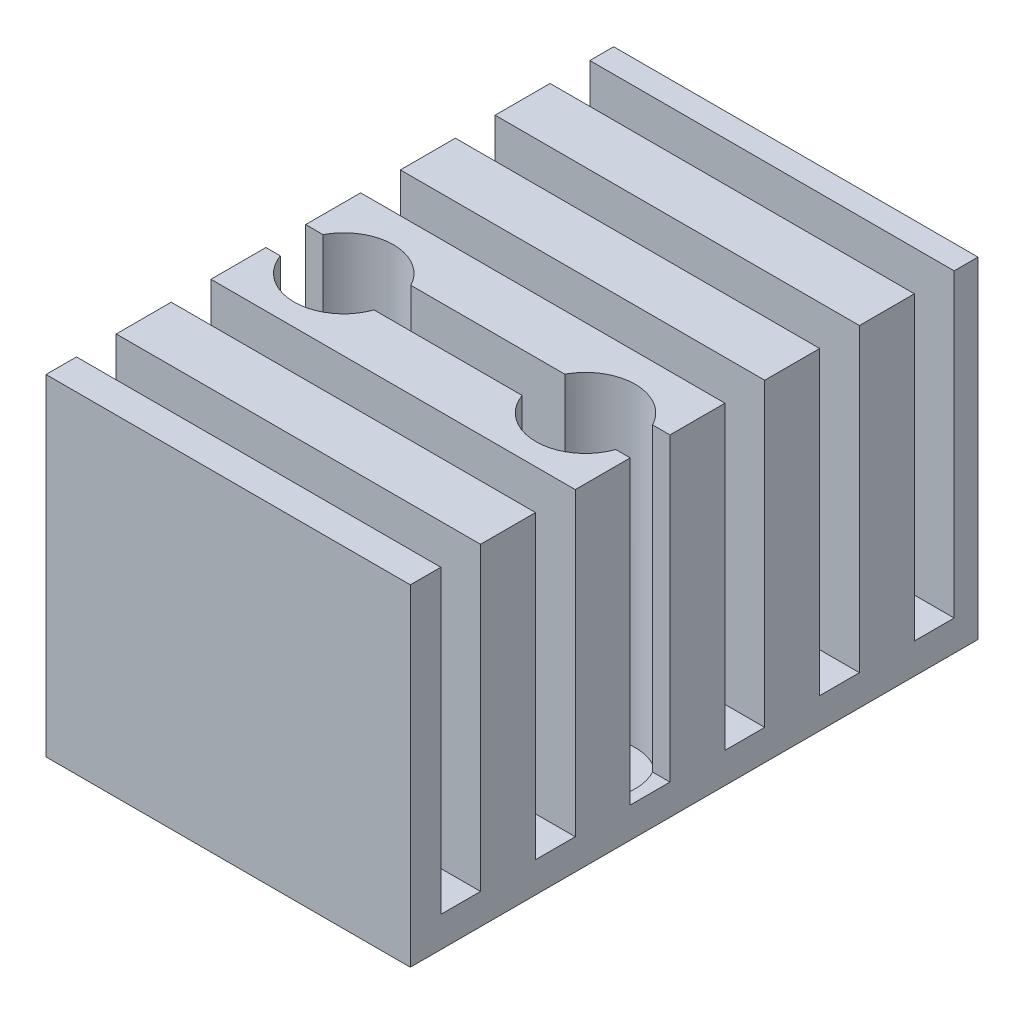
from build123d import *

# Parameters (mm, degrees)
SKETCH1_W           = 11
SKETCH1_H           = 17.14
SKETCH1_R           = 0.8
BOSS_EXTRUDE1_DEPTH = 10
SKETCH3_W           = 1.2
SKETCH3_H           = 9.077755084
CUT_EXTRUDE1_DEPTH  = 18.159396843
SKETCH4_R           = 1.5
CUT_EXTRUDE2_DEPTH  = 9.5


with BuildPart() as part:
    # Sketch1 → Boss-Extrude1 (new body)
    with BuildSketch(Plane(origin=(0, 0, 0), x_dir=(1, 0, 0), z_dir=(0, 1, 0))):
        Rectangle(SKETCH1_W, SKETCH1_H)
        with Locations(Location((3.65, -1.43, 0), (0, 0, 270))):
            Circle(SKETCH1_R, mode=Mode.SUBTRACT)
        with Locations(Location((-3.65, -1.43, 0), (0, 0, 270))):
            Circle(SKETCH1_R, mode=Mode.SUBTRACT)
    extrude(amount=BOSS_EXTRUDE1_DEPTH)

    # Sketch3 → Cut-Extrude1 (cut, through all)
    with BuildSketch(Plane(origin=(5.5, 0, 0), x_dir=(0, 0, -1), z_dir=(1, 0, 0))):
        with Locations((-4.19, 5.461122458)):
            Rectangle(SKETCH3_W, SKETCH3_H)
        with Locations((-7.05, 5.461122458)):
            Rectangle(SKETCH3_W, SKETCH3_H)
        with Locations((-1.33, 5.461122458)):
            Rectangle(SKETCH3_W, SKETCH3_H)
        with Locations((1.53, 5.461122458)):
            Rectangle(SKETCH3_W, SKETCH3_H)
        with Locations((4.39, 5.461122458)):
            Rectangle(SKETCH3_W, SKETCH3_H)
        with Locations((7.25, 5.461122458)):
            Rectangle(SKETCH3_W, SKETCH3_H)
    extrude(amount=-CUT_EXTRUDE1_DEPTH, mode=Mode.SUBTRACT)

    # Sketch4 → Cut-Extrude2 (cut)
    with BuildSketch(Plane(origin=(0, 10, 0), x_dir=(1, 0, 0), z_dir=(0, 1, 0))):
        with Locations(Location((-3.65, -1.43, 0), (0, 0, 270))):
            Circle(SKETCH4_R)
        with Locations(Location((3.65, -1.43, 0), (0, 0, 270))):
            Circle(SKETCH4_R)
    extrude(amount=-CUT_EXTRUDE2_DEPTH, mode=Mode.SUBTRACT)


solid = part.part
